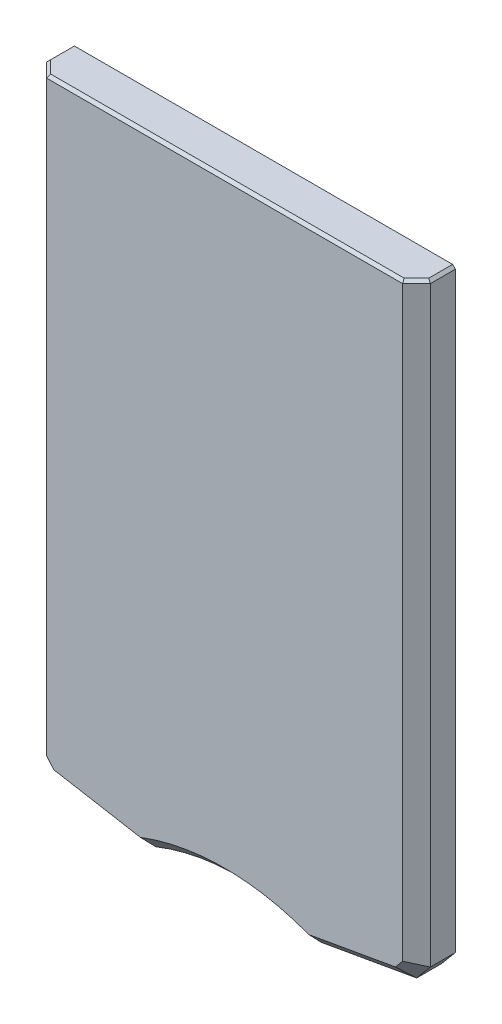
from build123d import *

# Parameters (mm, degrees)
BOSS_EXTRUDE1_DEPTH  = 7
F_2_5MM_CHAMFER_SIZE = 2.5
F_0_5MM_CHAMFER_SIZE = 0.5


with BuildPart() as part:
    # Sketch1 → Boss-Extrude1 (new body)
    with BuildSketch(Plane.XY):
        with BuildLine():
            Line((-32.037980617, 40.14916039), (-14.889638473, 37.125444996))
            ThreePointArc((-14.889638473, 37.125444996), (0, 40), (14.889638473, 37.125444996))
            Line((14.889638473, 37.125444996), (32.037980617, 40.14916039))
            Line((32.037980617, 40.14916039), (34.5, 43.083280834))
            Line((34.5, 43.083280834), (34.5, 150))
            Line((34.5, 150), (-34.5, 150))
            Line((-34.5, 150), (-34.5, 43.083280834))
            Line((-34.5, 43.083280834), (-32.037980617, 40.14916039))
        make_face()
    extrude(amount=BOSS_EXTRUDE1_DEPTH)

    # 2,5mm Chamfer
    f_2_5mm_chamfer_edges = [part.edges().sort_by_distance(p)[0] for p in [
        (23.463809545, 38.637302693, 7),
        (33.268990309, 41.616220612, 7),
        (34.5, 96.541640417, 7),
        (-34.5, 96.541640417, 7),
        (-33.268990309, 41.616220612, 7),
        (-23.463809545, 38.637302693, 7),
        (0, 40, 7),
    ]]
    chamfer(f_2_5mm_chamfer_edges, length=F_2_5MM_CHAMFER_SIZE)

    # 0,5mm Chamfer
    f_0_5mm_chamfer_edges = [part.edges().sort_by_distance(p)[0] for p in [
        (-34.5, 150, 2.25),
        (0, 150, 7),
        (34.5, 150, 2.25),
        (33.25, 150, 5.75),
        (-33.25, 150, 5.75),
    ]]
    chamfer(f_0_5mm_chamfer_edges, length=F_0_5MM_CHAMFER_SIZE)


solid = part.part
